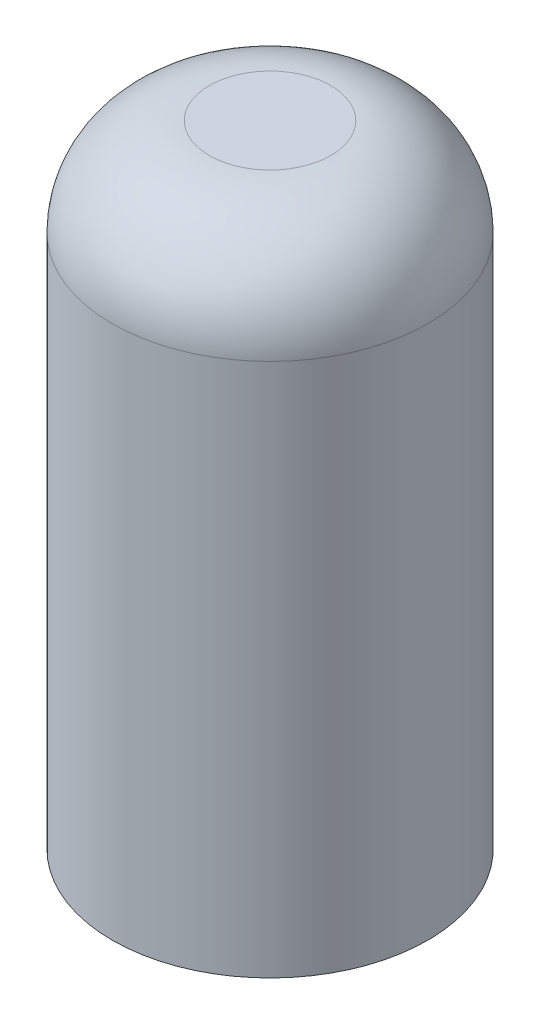
from build123d import *

# Parameters (mm, degrees)
SKETCH1_R           = 3.25
BOSS_EXTRUDE1_DEPTH = 13
FILLET2_R           = 2


with BuildPart() as part:
    # Sketch1 → Boss-Extrude1 (new body)
    with BuildSketch(Plane(origin=(0, 0, 0), x_dir=(1, 0, 0), z_dir=(0, 1, 0))):
        with Locations(Location((0, 0, 0), (0, 0, 270))):
            Circle(SKETCH1_R)
    extrude(amount=BOSS_EXTRUDE1_DEPTH)

    # Fillet2
    fillet2_edges = [part.edges().sort_by_distance(p)[0] for p in [
        (0, 13, -3.25),
    ]]
    fillet(fillet2_edges, radius=FILLET2_R)


solid = part.part
